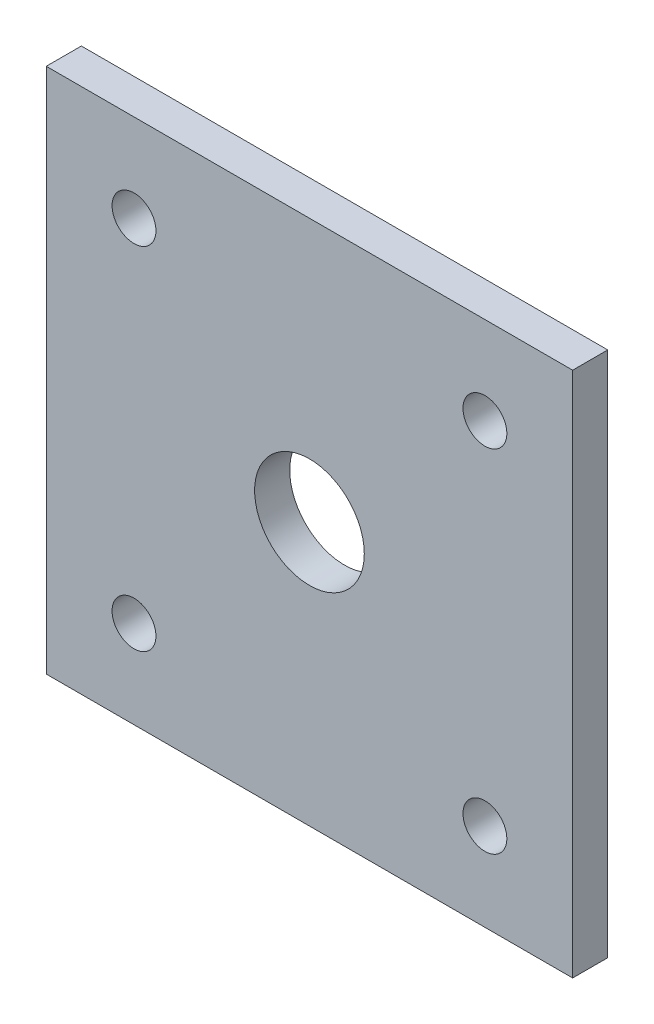
from build123d import *

# Parameters (mm, degrees)
SKETCH1_W            = 120
SKETCH1_H            = 120
BOSS_EXTRUDE1_DEPTH  = 8
SKETCH2_R            = 5
CUT_EXTRUDE1_DEPTH   = 86.229103011
LPATTERN1_COUNT      = 2
LPATTERN1_PITCH      = 80
LPATTERN1_COUNT_DIR2 = 2
LPATTERN1_PITCH_DIR2 = 80
SKETCH3_R            = 12.5
CUT_EXTRUDE2_DEPTH   = 86.229103011


with BuildPart() as part:
    # Sketch1 → Boss-Extrude1 (new body)
    with BuildSketch(Plane.XY):
        Rectangle(SKETCH1_W, SKETCH1_H)
    extrude(amount=BOSS_EXTRUDE1_DEPTH)

    # Sketch2 → Cut-Extrude1 (cut, through all)
    with BuildSketch(Plane.XY.offset(8)):
        with Locations((-40, 40)):
            Circle(SKETCH2_R)
    cut_extrude1 = extrude(amount=-CUT_EXTRUDE1_DEPTH, mode=Mode.SUBTRACT)

    # LPattern1: Cut-Extrude1 2 × 2
    with Locations(*[(i * LPATTERN1_PITCH, -j * LPATTERN1_PITCH_DIR2, 0) for i in range(LPATTERN1_COUNT) for j in range(LPATTERN1_COUNT_DIR2) if (i, j) != (0, 0)]):
        add(cut_extrude1, mode=Mode.SUBTRACT)

    # Sketch3 → Cut-Extrude2 (cut, through all)
    with BuildSketch(Plane.XY.offset(8)):
        Circle(SKETCH3_R)
    extrude(amount=-CUT_EXTRUDE2_DEPTH, mode=Mode.SUBTRACT)


solid = part.part
